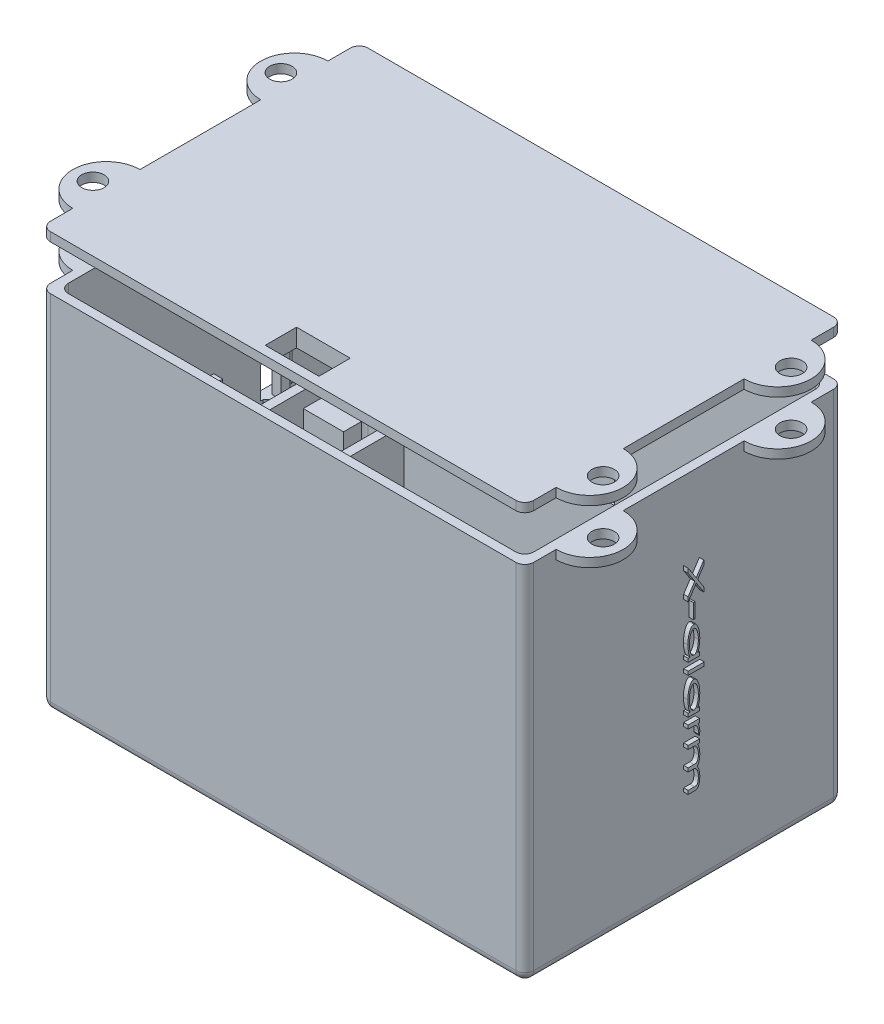
from build123d import *

# Parameters (mm, degrees)
SKETCH1_W                             = 108
SKETCH1_H                             = 71
SKETCH1_W_2                           = 104
SKETCH1_H_2                           = 67
BOX_DEPTH                             = 81
SKETCH3_W                             = 108
SKETCH3_H                             = 71
FRONT_DEPTH                           = 2
FILLET_2_R                            = 2
FILLET_IN_R                           = 2
FILLET2_R                             = 2
FILLET2_IN_R                          = 2
LCD_DEPTH                             = 37
LCD_DEPTH_BACK                        = 54
SKETCH4_W                             = 97
SKETCH4_H                             = 40
LCD_HOLE_START                        = -142
SKETCH5_R                             = 2
LCD_HOLE_DEPTH                        = 183
MIRROR_FOR_LCD_HOLES2_START           = -142
MIRROR_FOR_LCD_HOLES2_COPY_1_SKETCH_R = 2
MIRROR_FOR_LCD_HOLES2_COPY_1_DEPTH    = 183
SKETCH6_W                             = 10
SKETCH6_H                             = 15
SENCEOR_DEPTH                         = 0.5
BACK_DEPTH                            = 2
FILLET_BACK_R                         = 2
FOR_HOLES_DEPTH                       = 2
SKETCH11_R                            = 2.5
HOLES_DEPTH                           = 2
MIRROR_FOR_HOLES1_2_COPY_1_DEPTH      = 2
MIRROR_FOR_HOLES1_2_COPY_2_SKETCH_R   = 2.5
MIRROR_FOR_HOLES1_2_COPY_2_DEPTH      = 2
FOR_HOLES2_DEPTH                      = 2
SKETCH13_R                            = 2.5
HOLES2_DEPTH                          = 2
MIRROR_FOR_HOLES2_2_COPY_1_DEPTH      = 2
MIRROR_FOR_HOLES2_2_COPY_2_SKETCH_R   = 2.5
MIRROR_FOR_HOLES2_2_COPY_2_DEPTH      = 2
SKETCH15_R                            = 4
SKETCH15_W                            = 7
SKETCH15_H                            = 7
DATCHIKI_DEPTH                        = 2
SKETCH17_W                            = 2
SKETCH17_H                            = 14
KNOPKI_DEPTH                          = 2
SKETCH17_W_2                          = 17
SKETCH17_H_2                          = 17
SKETCH17_W_3                          = 13
SKETCH17_H_3                          = 13
KNOPKI_2_DEPTH                        = 2
KNOPKI_3_DEPTH                        = 2
SKETCH18_W                            = 0.358974359
SKETCH18_H                            = 3.320512821
SKETCH18_W_2                          = 3.58974359
SKETCH18_H_2                          = 0.807692307
ALARM_DEPTH                           = 1
SKETCH19_W                            = 104
SKETCH19_H                            = 67
BACK_FIXED_DEPTH                      = 2
BACK_FIXED_FILLET_R                   = 2
PODD_DEPTH                            = 3.5
PODD2_DEPTH                           = 3.5
PODD3_DEPTH                           = 17
ARDXUINO_DEPTH                        = 15
SKETCH23_W                            = 9
SKETCH23_H                            = 4
ARDUINO2_DEPTH                        = 45
SKETCH27_W                            = 12
SKETCH27_H                            = 7
PORT_DEPTH                            = 4
PODD_ARDUINO_DEPTH                    = 20


with BuildPart() as part:
    # Sketch1 → box (new body)
    with BuildSketch(Plane(origin=(0, 0, 0), x_dir=(1, 0, 0), z_dir=(0, 1, 0))):
        Rectangle(SKETCH1_W, SKETCH1_H)
        Rectangle(SKETCH1_W_2, SKETCH1_H_2, mode=Mode.SUBTRACT)
    extrude(amount=BOX_DEPTH)

    # Sketch3 → front (add)
    with BuildSketch(Plane.XZ):
        Rectangle(SKETCH3_W, SKETCH3_H)
    extrude(amount=-FRONT_DEPTH)

    # Fillet 2
    fillet_2_edges = [part.edges().sort_by_distance(p)[0] for p in [
        (54, 40.5, 35.5),
        (-54, 40.5, 35.5),
        (-54, 40.5, -35.5),
        (54, 40.5, -35.5),
    ]]
    fillet(fillet_2_edges, radius=FILLET_2_R)

    # Fillet_in
    fillet_in_edges = [part.edges().sort_by_distance(p)[0] for p in [
        (52, 41.5, 33.5),
        (52, 41.5, -33.5),
        (-52, 41.5, -33.5),
        (-52, 41.5, 33.5),
    ]]
    fillet(fillet_in_edges, radius=FILLET_IN_R)

    # Fillet2
    fillet2_edges = [part.edges().sort_by_distance(p)[0] for p in [
        (0, 0, -35.5),
        (54, 0, 0),
        (0, 0, 35.5),
        (-54, 0, 0),
        (53.414213562, 0, 34.914213562),
        (-53.414213562, 0, -34.914213562),
        (-53.414213562, 0, 34.914213562),
        (53.414213562, 0, -34.914213562),
    ]]
    fillet(fillet2_edges, radius=FILLET2_R)

    # Fillet2_in
    fillet2_in_edges = [part.edges().sort_by_distance(p)[0] for p in [
        (-52, 2, 0),
        (0, 2, 33.5),
        (52, 2, 0),
        (0, 2, -33.5),
        (51.414213562, 2, -32.914213562),
        (-51.414213562, 2, -32.914213562),
        (51.414213562, 2, 32.914213562),
        (-51.414213562, 2, 32.914213562),
    ]]
    fillet(fillet2_in_edges, radius=FILLET2_IN_R)

    # Sketch4 → lcd (cut, two sides: drawn at the far end of the back side and taken through both)
    with BuildSketch(Plane.XZ.offset(-LCD_DEPTH_BACK)):
        Rectangle(SKETCH4_W, SKETCH4_H)
    extrude(amount=LCD_DEPTH + LCD_DEPTH_BACK, mode=Mode.SUBTRACT)

    # Sketch5 → lcd_hole (cut)
    with BuildSketch(Plane.XZ.offset(LCD_HOLE_START)):
        with Locations(Location((-46, 27.5, 0), (0, 0, 90))):
            Circle(SKETCH5_R)
    lcd_hole = extrude(amount=LCD_HOLE_DEPTH, mode=Mode.SUBTRACT)

    # Mirror_for_lcd_holes: lcd_hole across plane
    add(lcd_hole.mirror(Plane(origin=(0, 0, 0), x_dir=(0, 0, 1), z_dir=(1, 0, 0))), mode=Mode.SUBTRACT)

    # Mirror_for_lcd_holes2: lcd_hole across plane
    add(lcd_hole.mirror(Plane.XY), mode=Mode.SUBTRACT)

    # Mirror_for_lcd_holes2 copy 1 sketch → Mirror_for_lcd_holes2 copy 1 (cut)
    with BuildSketch(Plane(origin=(0, 0, 0), x_dir=(-1, 0, 0), z_dir=(0, -1, 0)).offset(MIRROR_FOR_LCD_HOLES2_START)):
        with Locations(Location((-46, 27.5, 0), (0, 0, 90))):
            Circle(MIRROR_FOR_LCD_HOLES2_COPY_1_SKETCH_R)
    extrude(amount=MIRROR_FOR_LCD_HOLES2_COPY_1_DEPTH, mode=Mode.SUBTRACT)

    # Sketch6 → senceor (cut)
    with BuildSketch(Plane.XY.offset(-33.5)):
        with Locations((0, 41.5)):
            Rectangle(SKETCH6_W, SKETCH6_H)
    extrude(amount=-SENCEOR_DEPTH, mode=Mode.SUBTRACT)

    # Sketch12 → for_holes2 (add)
    with BuildSketch(Plane(origin=(0, 81, 0), x_dir=(1, 0, 0), z_dir=(0, 1, 0))):
        with BuildLine():
            Line((-54, 28.5), (-54, 13.5))
            ThreePointArc((-54, 13.5), (-61.5, 21), (-54, 28.5))
        make_face()
    for_holes2 = extrude(amount=-FOR_HOLES2_DEPTH)

    # Sketch13 → holes2 (cut)
    with BuildSketch(Plane(origin=(0, 81, 0), x_dir=(1, 0, 0), z_dir=(0, 1, 0))):
        with Locations(Location((-57, 21, 0), (0, 0, 270))):
            Circle(SKETCH13_R)
    holes2 = extrude(amount=-HOLES2_DEPTH, mode=Mode.SUBTRACT)

    # Mirror_for_holes2_1: for_holes2, holes2 across plane
    add(for_holes2.mirror(Plane(origin=(0, 0, 0), x_dir=(0, 0, 1), z_dir=(1, 0, 0))))
    add(holes2.mirror(Plane(origin=(0, 0, 0), x_dir=(0, 0, 1), z_dir=(1, 0, 0))), mode=Mode.SUBTRACT)

    # Mirror_for_holes2_2: for_holes2, holes2 across plane
    add(for_holes2.mirror(Plane.XY))
    add(holes2.mirror(Plane.XY), mode=Mode.SUBTRACT)

    # Mirror_for_holes2_2 copy 1 sketch → Mirror_for_holes2_2 copy 1 (add)
    with BuildSketch(Plane(origin=(0, 81, 0), x_dir=(-1, 0, 0), z_dir=(0, 1, 0))):
        with BuildLine():
            Line((-54, 28.5), (-54, 13.5))
            ThreePointArc((-54, 13.5), (-61.5, 21), (-54, 28.5))
        make_face()
    extrude(amount=-MIRROR_FOR_HOLES2_2_COPY_1_DEPTH)

    # Mirror_for_holes2_2 copy 2 sketch → Mirror_for_holes2_2 copy 2 (cut)
    with BuildSketch(Plane(origin=(0, 81, 0), x_dir=(-1, 0, 0), z_dir=(0, 1, 0))):
        with Locations(Location((-57, 21, 0), (0, 0, 270))):
            Circle(MIRROR_FOR_HOLES2_2_COPY_2_SKETCH_R)
    extrude(amount=-MIRROR_FOR_HOLES2_2_COPY_2_DEPTH, mode=Mode.SUBTRACT)

    # Sketch15 → datchiki (cut)
    with BuildSketch(Plane.ZY.offset(54)):
        with Locations((15, 40.228974626)):
            Circle(SKETCH15_R)
        with Locations((0, 40.228974626)):
            Rectangle(SKETCH15_W, SKETCH15_H)
        with Locations((-15, 40.228974626)):
            Rectangle(SKETCH15_W, SKETCH15_H)
    extrude(amount=-DATCHIKI_DEPTH, mode=Mode.SUBTRACT)

    # Sketch18 → Alarm (add)
    # profile 1 of 7: a face of its own
    with BuildSketch(Plane(origin=(54, 0, 0), x_dir=(0, 0, -1), z_dir=(1, 0, 0))):
        Polygon((3.5, 63.442307692), (3.5, 62.436899038), (2.136318109, 60.346153846), (3.5, 58.255408654), (3.5, 57.25), (1.808193109, 59.843449519), (0, 57.070512821), (0, 58.075921474), (1.480769231, 60.346153846), (0, 62.616386218), (0, 63.621794872), (1.808193109, 60.848858173), align=None)
    # profile 2 of 7: a face of its own
    with BuildSketch(Plane(origin=(54, 0, 0), x_dir=(0, 0, -1), z_dir=(1, 0, 0))):
        with Locations((1.346153847, 54.71474359)):
            Rectangle(SKETCH18_W, SKETCH18_H)
    # profile 3 of 7: a face of its own
    with BuildSketch(Plane(origin=(54, 0, 0), x_dir=(0, 0, -1), z_dir=(1, 0, 0))):
        with BuildLine():
            Line((2.557692308, 45.381410256), (0, 45.381410256))
            Line((0, 45.381410256), (0, 46.189102564))
            Line((0, 46.189102564), (0.442407853, 46.189102564))
            add(Edge.make_bspline(
                [(0.442407853, 46.189102564), (0.421742508, 46.233358568), (0.380195973, 46.322332825), (0.323530054, 46.459459638), (0.270880462, 46.600459146), (0.222671903, 46.745509289), (0.178374322, 46.894429895), (0.13846366, 47.047375689), (0.102715228, 47.204510644), (0.060422561, 47.421461974), (0.017737864, 47.702491354), (-0.018087637, 48.051595219), (-0.041444755, 48.415779956), (-0.043714399, 48.663791793), (-0.044871795, 48.790264423)],
                knots=[0, 0, 0, 0, 0.658903647, 1.324689472, 2.001141346, 2.689134916, 3.386479509, 4.096959253, 4.821324554, 5.560283517, 7.078698024, 8.654333912, 10.293891161, 12, 12, 12, 12], degree=3))
            add(Edge.make_bspline(
                [(-0.044871795, 48.790264423), (-0.043658669, 48.902936742), (-0.041278605, 49.123991562), (-0.022620965, 49.449335978), (0.007214859, 49.762082107), (0.048780764, 50.062368245), (0.103673512, 50.349876721), (0.170043118, 50.624907515), (0.24823488, 50.887756837), (0.324667565, 51.096708767), (0.390361022, 51.255125825), (0.440946024, 51.365478839), (0.492560871, 51.468177648), (0.545167183, 51.563687793), (0.599912146, 51.650902714), (0.654997211, 51.731569161), (0.712672065, 51.803511408), (0.77074011, 51.868610603), (0.830713797, 51.925585351), (0.891274094, 51.975588629), (0.953806427, 52.017523545), (1.017411689, 52.051835498), (1.082588768, 52.079175872), (1.149321256, 52.097568254), (1.217110979, 52.110587419), (1.262892458, 52.111647653), (1.285857372, 52.112179487)],
                knots=[0, 0, 0, 0, 2.117711671, 4.154794888, 6.12308041, 8.02159497, 9.850641729, 11.622476382, 13.337480136, 15.002332578, 15.801827085, 16.560566352, 17.283516775, 17.9619206, 18.609158598, 19.218432771, 19.796769753, 20.341072745, 20.856851243, 21.35014048, 21.815552153, 22.269567342, 22.706824669, 23.140670544, 23.568943012, 24, 24, 24, 24], degree=3))
            add(Edge.make_bspline(
                [(1.285857372, 52.112179487), (1.308357317, 52.111650212), (1.353215543, 52.110594995), (1.419590237, 52.097531949), (1.485292664, 52.07919942), (1.549074495, 52.051098329), (1.611983853, 52.016755618), (1.673188727, 51.974044167), (1.733562727, 51.92422119), (1.79247685, 51.866372639), (1.85004404, 51.800939492), (1.905977828, 51.727522521), (1.961557106, 51.647153447), (2.014540151, 51.558177388), (2.067094441, 51.462030248), (2.118989584, 51.358628101), (2.168685579, 51.247043295), (2.234466109, 51.087448092), (2.30993994, 50.876349965), (2.388342097, 50.611583002), (2.454980724, 50.334527936), (2.508444719, 50.044677024), (2.551393639, 49.74275266), (2.58116728, 49.428313072), (2.598743712, 49.101531663), (2.601274286, 48.879562453), (2.602564103, 48.766426282)],
                knots=[0, 0, 0, 0, 0.421043031, 0.839435093, 1.263587672, 1.697222692, 2.142211334, 2.605097439, 3.093552727, 3.60770482, 4.15076294, 4.72545226, 5.336542515, 5.981032255, 6.665114799, 7.389857283, 8.14854633, 8.953786346, 10.624612737, 12.347172321, 14.126577142, 15.962352381, 17.868914583, 19.840140219, 21.879748244, 24, 24, 24, 24], degree=3))
            add(Edge.make_bspline(
                [(2.602564103, 48.766426282), (2.602102073, 48.700751331), (2.601189357, 48.57101382), (2.595683157, 48.378613612), (2.585714891, 48.19115757), (2.572618651, 48.008318171), (2.555105675, 47.830168901), (2.533377519, 47.656729405), (2.508044742, 47.487956843), (2.479534059, 47.323984888), (2.446864052, 47.164856738), (2.408837459, 47.010764971), (2.366053989, 46.861628086), (2.319271578, 46.717258885), (2.267906003, 46.577823717), (2.212123918, 46.443396042), (2.150926858, 46.313951806), (2.106500115, 46.230533273), (2.084435096, 46.189102564)],
                knots=[0, 0, 0, 0, 1.186802157, 2.344467023, 3.477842513, 4.578816703, 5.656706767, 6.712224733, 7.737145181, 8.740441498, 9.71945348, 10.672047839, 11.607763232, 12.522612191, 13.413838984, 14.292275929, 15.151840519, 16, 16, 16, 16], degree=3))
            Line((2.084435096, 46.189102564), (2.557692308, 46.189102564))
            Line((2.557692308, 46.189102564), (2.557692308, 45.381410256))
        make_face()
        with BuildLine():
            add(Edge.make_bspline(
                [(2.288461538, 48.721554487), (2.288090591, 48.779287629), (2.287355982, 48.893620155), (2.28048543, 49.063543909), (2.271385159, 49.230308896), (2.256076478, 49.393406088), (2.238445377, 49.553218182), (2.21472026, 49.709483282), (2.188644495, 49.862761348), (2.157553265, 50.011844322), (2.123864312, 50.15534931), (2.085803828, 50.291891763), (2.044558775, 50.421050434), (1.999895553, 50.542700567), (1.952114542, 50.656952508), (1.901133087, 50.763575815), (1.846482204, 50.862691242), (1.788591876, 50.953528529), (1.728850428, 51.035038524), (1.668386761, 51.106713446), (1.606866998, 51.167658069), (1.543443001, 51.216733338), (1.480009195, 51.256508573), (1.414953031, 51.28405538), (1.348885008, 51.301031127), (1.30441553, 51.303341083), (1.282351763, 51.304487179)],
                knots=[0, 0, 0, 0, 1.405801486, 2.783995975, 4.140815387, 5.472212889, 6.772535348, 8.055467822, 9.32043852, 10.558232987, 11.763305795, 12.909349428, 14.00902537, 15.064134583, 16.064017755, 17.023653367, 17.940695263, 18.81847006, 19.6448539, 20.399797193, 21.100054987, 21.748938425, 22.349206193, 22.917887624, 23.463104187, 24, 24, 24, 24], degree=3))
            add(Edge.make_bspline(
                [(1.282351763, 51.304487179), (1.260535547, 51.303298352), (1.216328534, 51.300889386), (1.150419414, 51.284420392), (1.086040329, 51.255194688), (1.022070191, 51.216586114), (0.9589866, 51.166423369), (0.89697474, 51.105370189), (0.83590268, 51.032900298), (0.775306973, 50.950948465), (0.717653712, 50.858960816), (0.662097252, 50.759420317), (0.610553293, 50.652025408), (0.561805665, 50.537261169), (0.517564068, 50.414582328), (0.47518687, 50.284720908), (0.436777272, 50.147136483), (0.390109395, 49.952433817), (0.340480963, 49.699064739), (0.30002991, 49.384750808), (0.273801971, 49.059708416), (0.270770304, 48.839161234), (0.269230769, 48.727163462)],
                knots=[0, 0, 0, 0, 0.443475571, 0.898631151, 1.370896731, 1.876069969, 2.414026017, 3.00533102, 3.642267512, 4.338788751, 5.075578177, 5.847598851, 6.655060735, 7.496002732, 8.38128539, 9.3052925, 10.27245836, 11.28420018, 13.375075964, 15.517196243, 17.723552707, 20, 20, 20, 20], degree=3))
            add(Edge.make_bspline(
                [(0.269230769, 48.727163462), (0.270869782, 48.614005737), (0.274107692, 48.390459955), (0.29916008, 48.059505831), (0.340267262, 47.737676352), (0.388328754, 47.476788456), (0.435684297, 47.276795456), (0.472182519, 47.135717259), (0.512955743, 47.003874397), (0.556491806, 46.880860724), (0.602255135, 46.766323491), (0.652309689, 46.661313477), (0.703969072, 46.5644285), (0.759179312, 46.477126785), (0.816395072, 46.398970251), (0.875981508, 46.331071589), (0.938057406, 46.274086845), (1.000915873, 46.226334916), (1.066447187, 46.190026639), (1.133624633, 46.163947759), (1.202729435, 46.146705453), (1.249767228, 46.145054519), (1.273237179, 46.144230769)],
                knots=[0, 0, 0, 0, 2.287805913, 4.519615117, 6.706427786, 8.845503663, 9.879377515, 10.861651196, 11.791346721, 12.668660028, 13.499648939, 14.283855059, 15.019640971, 15.718396161, 16.370521181, 16.976426115, 17.541602888, 18.071798331, 18.56886665, 19.050627751, 19.526301731, 20, 20, 20, 20], degree=3))
            add(Edge.make_bspline(
                [(1.273237179, 46.144230769), (1.291046945, 46.14468472), (1.326669551, 46.145592701), (1.379364155, 46.155635809), (1.431383537, 46.168957402), (1.481861782, 46.189885065), (1.530709424, 46.216943192), (1.579549192, 46.248315209), (1.62666972, 46.286508841), (1.671811826, 46.331128578), (1.717281733, 46.380127099), (1.760349921, 46.435990599), (1.803216121, 46.496866669), (1.844738408, 46.563771382), (1.884308828, 46.636892854), (1.923743569, 46.715288556), (1.96148645, 46.799888897), (2.011385475, 46.921094678), (2.068011757, 47.082257824), (2.127701921, 47.284569692), (2.177448662, 47.498118237), (2.21742031, 47.722175205), (2.250249172, 47.956917204), (2.27167968, 48.202413092), (2.286589565, 48.458448893), (2.28782951, 48.632722901), (2.288461538, 48.721554487)],
                knots=[0, 0, 0, 0, 0.431395842, 0.862866158, 1.297378955, 1.732113537, 2.183598473, 2.650546566, 3.138326813, 3.651435843, 4.189069441, 4.758314972, 5.360609127, 5.994509329, 6.666760467, 7.376558362, 8.122466708, 8.913002397, 10.555258885, 12.262816725, 14.026869162, 15.870315974, 17.781438047, 19.773658302, 21.845733618, 24, 24, 24, 24], degree=3))
        make_face(mode=Mode.SUBTRACT)
    # profile 4 of 7: a face of its own
    with BuildSketch(Plane(origin=(54, 0, 0), x_dir=(0, 0, -1), z_dir=(1, 0, 0))):
        with Locations((1.794871795, 43.272435898)):
            Rectangle(SKETCH18_W_2, SKETCH18_H_2)
    # profile 5 of 7: a face of its own
    with BuildSketch(Plane(origin=(54, 0, 0), x_dir=(0, 0, -1), z_dir=(1, 0, 0))):
        with BuildLine():
            Line((2.557692308, 34.746794872), (0, 34.746794872))
            Line((0, 34.746794872), (0, 35.554487179))
            Line((0, 35.554487179), (0.442407853, 35.554487179))
            add(Edge.make_bspline(
                [(0.442407853, 35.554487179), (0.421742508, 35.598743183), (0.380195973, 35.68771744), (0.323530054, 35.824844253), (0.270880462, 35.965843762), (0.222671903, 36.110893905), (0.178374322, 36.25981451), (0.13846366, 36.412760305), (0.102715228, 36.569895259), (0.060422561, 36.78684659), (0.017737864, 37.067875969), (-0.018087637, 37.416979834), (-0.041444755, 37.781164571), (-0.043714399, 38.029176409), (-0.044871795, 38.155649038)],
                knots=[0, 0, 0, 0, 0.658903647, 1.324689472, 2.001141346, 2.689134916, 3.386479509, 4.096959253, 4.821324554, 5.560283517, 7.078698024, 8.654333912, 10.293891161, 12, 12, 12, 12], degree=3))
            add(Edge.make_bspline(
                [(-0.044871795, 38.155649038), (-0.043658669, 38.268321357), (-0.041278605, 38.489376177), (-0.022620965, 38.814720594), (0.007214859, 39.127466722), (0.048780764, 39.427752861), (0.103673512, 39.715261336), (0.170043118, 39.99029213), (0.24823488, 40.253141453), (0.324667565, 40.462093382), (0.390361022, 40.62051044), (0.440946024, 40.730863455), (0.492560871, 40.833562263), (0.545167183, 40.929072409), (0.599912146, 41.01628733), (0.654997211, 41.096953776), (0.712672065, 41.168896023), (0.77074011, 41.233995219), (0.830713797, 41.290969966), (0.891274094, 41.340973244), (0.953806427, 41.382908161), (1.017411689, 41.417220113), (1.082588768, 41.444560487), (1.149321256, 41.46295287), (1.217110979, 41.475972035), (1.262892458, 41.477032268), (1.285857372, 41.477564103)],
                knots=[0, 0, 0, 0, 2.117711671, 4.154794888, 6.12308041, 8.02159497, 9.850641729, 11.622476382, 13.337480136, 15.002332578, 15.801827085, 16.560566352, 17.283516775, 17.9619206, 18.609158598, 19.218432771, 19.796769753, 20.341072745, 20.856851243, 21.35014048, 21.815552153, 22.269567342, 22.706824669, 23.140670544, 23.568943012, 24, 24, 24, 24], degree=3))
            add(Edge.make_bspline(
                [(1.285857372, 41.477564103), (1.308357317, 41.477034828), (1.353215543, 41.47597961), (1.419590237, 41.462916565), (1.485292664, 41.444584035), (1.549074495, 41.416482944), (1.611983853, 41.382140234), (1.673188727, 41.339428783), (1.733562727, 41.289605806), (1.79247685, 41.231757255), (1.85004404, 41.166324107), (1.905977828, 41.092907136), (1.961557106, 41.012538062), (2.014540151, 40.923562003), (2.067094441, 40.827414863), (2.118989584, 40.724012716), (2.168685579, 40.61242791), (2.234466109, 40.452832707), (2.30993994, 40.24173458), (2.388342097, 39.976967618), (2.454980724, 39.699912551), (2.508444719, 39.410061639), (2.551393639, 39.108137276), (2.58116728, 38.793697688), (2.598743712, 38.466916279), (2.601274286, 38.244947068), (2.602564103, 38.131810897)],
                knots=[0, 0, 0, 0, 0.421043031, 0.839435093, 1.263587672, 1.697222692, 2.142211334, 2.605097439, 3.093552727, 3.60770482, 4.15076294, 4.72545226, 5.336542515, 5.981032255, 6.665114799, 7.389857283, 8.14854633, 8.953786346, 10.624612737, 12.347172321, 14.126577142, 15.962352381, 17.868914583, 19.840140219, 21.879748244, 24, 24, 24, 24], degree=3))
            add(Edge.make_bspline(
                [(2.602564103, 38.131810897), (2.602102073, 38.066135946), (2.601189357, 37.936398436), (2.595683157, 37.743998227), (2.585714891, 37.556542185), (2.572618651, 37.373702787), (2.555105675, 37.195553516), (2.533377519, 37.02211402), (2.508044742, 36.853341458), (2.479534059, 36.689369504), (2.446864052, 36.530241354), (2.408837459, 36.376149586), (2.366053989, 36.227012702), (2.319271578, 36.0826435), (2.267906003, 35.943208332), (2.212123918, 35.808780658), (2.150926858, 35.679336422), (2.106500115, 35.595917889), (2.084435096, 35.554487179)],
                knots=[0, 0, 0, 0, 1.186802157, 2.344467023, 3.477842513, 4.578816703, 5.656706767, 6.712224733, 7.737145181, 8.740441498, 9.71945348, 10.672047839, 11.607763232, 12.522612191, 13.413838984, 14.292275929, 15.151840519, 16, 16, 16, 16], degree=3))
            Line((2.084435096, 35.554487179), (2.557692308, 35.554487179))
            Line((2.557692308, 35.554487179), (2.557692308, 34.746794872))
        make_face()
        with BuildLine():
            add(Edge.make_bspline(
                [(2.288461538, 38.086939103), (2.288090591, 38.144672245), (2.287355982, 38.259004771), (2.28048543, 38.428928524), (2.271385159, 38.595693511), (2.256076478, 38.758790704), (2.238445377, 38.918602797), (2.21472026, 39.074867898), (2.188644495, 39.228145963), (2.157553265, 39.377228938), (2.123864312, 39.520733926), (2.085803828, 39.657276378), (2.044558775, 39.78643505), (1.999895553, 39.908085183), (1.952114542, 40.022337123), (1.901133087, 40.12896043), (1.846482204, 40.228075857), (1.788591876, 40.318913144), (1.728850428, 40.400423139), (1.668386761, 40.472098062), (1.606866998, 40.533042684), (1.543443001, 40.582117953), (1.480009195, 40.621893189), (1.414953031, 40.649439995), (1.348885008, 40.666415743), (1.30441553, 40.668725698), (1.282351763, 40.669871795)],
                knots=[0, 0, 0, 0, 1.405801486, 2.783995975, 4.140815387, 5.472212889, 6.772535348, 8.055467822, 9.32043852, 10.558232987, 11.763305795, 12.909349428, 14.00902537, 15.064134583, 16.064017755, 17.023653367, 17.940695263, 18.81847006, 19.6448539, 20.399797193, 21.100054987, 21.748938425, 22.349206193, 22.917887624, 23.463104187, 24, 24, 24, 24], degree=3))
            add(Edge.make_bspline(
                [(1.282351763, 40.669871795), (1.260535547, 40.668682967), (1.216328534, 40.666274002), (1.150419414, 40.649805007), (1.086040329, 40.620579303), (1.022070191, 40.581970729), (0.9589866, 40.531807985), (0.89697474, 40.470754804), (0.83590268, 40.398284913), (0.775306973, 40.31633308), (0.717653712, 40.224345432), (0.662097252, 40.124804932), (0.610553293, 40.017410024), (0.561805665, 39.902645784), (0.517564068, 39.779966943), (0.47518687, 39.650105524), (0.436777272, 39.512521098), (0.390109395, 39.317818432), (0.340480963, 39.064449354), (0.30002991, 38.750135423), (0.273801971, 38.425093031), (0.270770304, 38.204545849), (0.269230769, 38.092548077)],
                knots=[0, 0, 0, 0, 0.443475571, 0.898631151, 1.370896731, 1.876069969, 2.414026017, 3.00533102, 3.642267512, 4.338788751, 5.075578177, 5.847598851, 6.655060735, 7.496002732, 8.38128539, 9.3052925, 10.27245836, 11.28420018, 13.375075964, 15.517196243, 17.723552707, 20, 20, 20, 20], degree=3))
            add(Edge.make_bspline(
                [(0.269230769, 38.092548077), (0.270869782, 37.979390353), (0.274107692, 37.755844571), (0.29916008, 37.424890447), (0.340267262, 37.103060967), (0.388328754, 36.842173071), (0.435684297, 36.642180072), (0.472182519, 36.501101874), (0.512955743, 36.369259013), (0.556491806, 36.246245339), (0.602255135, 36.131708106), (0.652309689, 36.026698092), (0.703969072, 35.929813115), (0.759179312, 35.8425114), (0.816395072, 35.764354866), (0.875981508, 35.696456204), (0.938057406, 35.639471461), (1.000915873, 35.591719531), (1.066447187, 35.555411255), (1.133624633, 35.529332374), (1.202729435, 35.512090069), (1.249767228, 35.510439134), (1.273237179, 35.509615385)],
                knots=[0, 0, 0, 0, 2.287805913, 4.519615117, 6.706427786, 8.845503663, 9.879377515, 10.861651196, 11.791346721, 12.668660028, 13.499648939, 14.283855059, 15.019640971, 15.718396161, 16.370521181, 16.976426115, 17.541602888, 18.071798331, 18.56886665, 19.050627751, 19.526301731, 20, 20, 20, 20], degree=3))
            add(Edge.make_bspline(
                [(1.273237179, 35.509615385), (1.291046945, 35.510069336), (1.326669551, 35.510977316), (1.379364155, 35.521020425), (1.431383537, 35.534342017), (1.481861782, 35.55526968), (1.530709424, 35.582327807), (1.579549192, 35.613699824), (1.62666972, 35.651893457), (1.671811826, 35.696513193), (1.717281733, 35.745511714), (1.760349921, 35.801375214), (1.803216121, 35.862251284), (1.844738408, 35.929155998), (1.884308828, 36.002277469), (1.923743569, 36.080673171), (1.96148645, 36.165273512), (2.011385475, 36.286479294), (2.068011757, 36.447642439), (2.127701921, 36.649954308), (2.177448662, 36.863502852), (2.21742031, 37.08755982), (2.250249172, 37.322301819), (2.27167968, 37.567797707), (2.286589565, 37.823833509), (2.28782951, 37.998107516), (2.288461538, 38.086939103)],
                knots=[0, 0, 0, 0, 0.431395842, 0.862866158, 1.297378955, 1.732113537, 2.183598473, 2.650546566, 3.138326813, 3.651435843, 4.189069441, 4.758314972, 5.360609127, 5.994509329, 6.666760467, 7.376558362, 8.122466708, 8.913002397, 10.555258885, 12.262816725, 14.026869162, 15.870315974, 17.781438047, 19.773658302, 21.845733618, 24, 24, 24, 24], degree=3))
        make_face(mode=Mode.SUBTRACT)
    # profile 6 of 7: a face of its own
    with BuildSketch(Plane(origin=(54, 0, 0), x_dir=(0, 0, -1), z_dir=(1, 0, 0))):
        with BuildLine():
            Line((2.557692308, 33.266025641), (2.557692308, 32.458333333))
            Line((2.557692308, 32.458333333), (2.181189904, 32.458333333))
            add(Edge.make_bspline(
                [(2.181189904, 32.458333333), (2.216770522, 32.393161728), (2.28756922, 32.263482565), (2.375854138, 32.060603506), (2.447969467, 31.852504596), (2.50564591, 31.639492053), (2.548521055, 31.421459776), (2.580453975, 31.199196897), (2.598765447, 30.972031802), (2.601290065, 30.819142226), (2.602564103, 30.741987179)],
                knots=[0, 0, 0, 0, 0.996469437, 1.982785624, 2.966128, 3.951010882, 4.942920497, 5.947502343, 6.964216161, 8, 8, 8, 8], degree=3))
            add(Edge.make_bspline(
                [(2.602564103, 30.741987179), (2.601398056, 30.682356852), (2.599025385, 30.561021071), (2.58200987, 30.375894547), (2.555161892, 30.184593612), (2.528503495, 30.05592671), (2.514923878, 29.990384615)],
                knots=[0, 0, 0, 0, 0.943831684, 1.920508571, 2.940720417, 4, 4, 4, 4], degree=3))
            Line((2.514923878, 29.990384615), (2.242888622, 30.418770032))
            add(Edge.make_bspline(
                [(2.242888622, 30.418770032), (2.2496529, 30.461739763), (2.26260655, 30.544027155), (2.277667845, 30.662256672), (2.286578379, 30.770126663), (2.287854781, 30.838494062), (2.288461538, 30.87099359)],
                knots=[0, 0, 0, 0, 1.147204346, 2.196905842, 3.142870602, 4, 4, 4, 4], degree=3))
            add(Edge.make_bspline(
                [(2.288461538, 30.87099359), (2.28687032, 30.941649047), (2.283709244, 31.082011502), (2.257511115, 31.290490514), (2.215448715, 31.495178684), (2.166779212, 31.661702978), (2.119656436, 31.790304646), (2.07872839, 31.880762787), (2.034162448, 31.965906734), (1.98434774, 32.044807168), (1.92903334, 32.117167636), (1.870461205, 32.184835655), (1.806634254, 32.246160852), (1.760376808, 32.282041606), (1.737379808, 32.299879808)],
                knots=[0, 0, 0, 0, 1.604899353, 3.18825498, 4.765982142, 6.348803436, 7.12505152, 7.876099285, 8.602955166, 9.30711211, 9.993177446, 10.670536201, 11.339053906, 12, 12, 12, 12], degree=3))
            add(Edge.make_bspline(
                [(1.737379808, 32.299879808), (1.717383656, 32.312885522), (1.67452628, 32.340760424), (1.598135364, 32.371870301), (1.508702854, 32.398994176), (1.405500594, 32.421153928), (1.288514879, 32.43720483), (1.158034584, 32.450087787), (1.01341708, 32.456467978), (0.912397707, 32.457692854), (0.859575321, 32.458333333)],
                knots=[0, 0, 0, 0, 0.632497709, 1.355620455, 2.180469504, 3.114526086, 4.155889769, 5.316106813, 6.596609361, 8, 8, 8, 8], degree=3))
            Line((0.859575321, 32.458333333), (0, 32.458333333))
            Line((0, 32.458333333), (0, 33.266025641))
            Line((0, 33.266025641), (2.557692308, 33.266025641))
        make_face()
    # profile 7 of 7: a face of its own
    with BuildSketch(Plane(origin=(54, 0, 0), x_dir=(0, 0, -1), z_dir=(1, 0, 0))):
        with BuildLine():
            Line((2.557692308, 29.317307692), (2.557692308, 28.509615385))
            Line((2.557692308, 28.509615385), (2.11318109, 28.509615385))
            add(Edge.make_bspline(
                [(2.11318109, 28.509615385), (2.152552786, 28.438161648), (2.230509685, 28.296681544), (2.328280876, 28.076832942), (2.41056328, 27.854634303), (2.452181425, 27.703423897), (2.472856571, 27.628305288)],
                knots=[0, 0, 0, 0, 1.025009336, 2.02954295, 3.021112399, 4, 4, 4, 4], degree=3))
            add(Edge.make_bspline(
                [(2.472856571, 27.628305288), (2.49296111, 27.523328858), (2.533495671, 27.311676475), (2.573195271, 26.987604304), (2.597524425, 26.655527267), (2.600871502, 26.431299572), (2.602564103, 26.317908654)],
                knots=[0, 0, 0, 0, 0.972195158, 1.960129712, 2.968446937, 4, 4, 4, 4], degree=3))
            add(Edge.make_bspline(
                [(2.602564103, 26.317908654), (2.601514942, 26.24146945), (2.599443911, 26.090579364), (2.58620121, 25.867124681), (2.562957905, 25.649588109), (2.531192398, 25.439958975), (2.49182315, 25.24296275), (2.446610163, 25.062566071), (2.395364053, 24.90112981), (2.336737438, 24.756808879), (2.268479555, 24.626165339), (2.187238342, 24.50680744), (2.093747619, 24.395004032), (2.021457481, 24.329647513), (1.984875801, 24.296574519)],
                knots=[0, 0, 0, 0, 1.264371881, 2.495855161, 3.700991407, 4.881896394, 6.001647533, 7.022666807, 7.956662252, 8.800880844, 9.596312771, 10.389722549, 11.185135689, 12, 12, 12, 12], degree=3))
            add(Edge.make_bspline(
                [(1.984875801, 24.296574519), (2.00986823, 24.261821937), (2.060354979, 24.191618882), (2.128565897, 24.079421033), (2.193607225, 23.961612914), (2.252520029, 23.836647247), (2.308556876, 23.705979244), (2.35833195, 23.568523026), (2.405217567, 23.425164477), (2.445688649, 23.275625057), (2.483240143, 23.121955883), (2.514359532, 22.964384904), (2.541758722, 22.804282822), (2.564555668, 22.641127273), (2.580739833, 22.475002534), (2.59390375, 22.306034527), (2.60056986, 22.134134711), (2.601895931, 22.018634241), (2.602564103, 21.960436699)],
                knots=[0, 0, 0, 0, 0.836702089, 1.690206606, 2.565489576, 3.466877, 4.390326977, 5.344505649, 6.324296002, 7.338694482, 8.372787504, 9.416848499, 10.478374116, 11.548578826, 12.637133533, 13.741495583, 14.862001114, 16, 16, 16, 16], degree=3))
            add(Edge.make_bspline(
                [(2.602564103, 21.960436699), (2.602161586, 21.906444809), (2.601366727, 21.799825799), (2.595034019, 21.642465613), (2.584243304, 21.48984161), (2.570787637, 21.341966755), (2.551704492, 21.198882612), (2.528380113, 21.060768673), (2.502267789, 20.927251768), (2.470526303, 20.799452608), (2.435821679, 20.678026882), (2.39802863, 20.563980808), (2.35697883, 20.458024564), (2.311806429, 20.360392706), (2.264575629, 20.270278423), (2.213109755, 20.188566116), (2.158624046, 20.114638133), (2.099956482, 20.048679458), (2.036282446, 19.989904855), (1.964854664, 19.94017003), (1.886348832, 19.897702482), (1.800372739, 19.863577192), (1.707140472, 19.836795531), (1.606370931, 19.818467372), (1.49837779, 19.805945047), (1.423782838, 19.80498233), (1.385416667, 19.804487179)],
                knots=[0, 0, 0, 0, 1.392185431, 2.749180156, 4.060000931, 5.337242931, 6.577322499, 7.781038535, 8.948704855, 10.084364722, 11.175369013, 12.204432676, 13.181394714, 14.103571343, 14.977026951, 15.80297757, 16.591221793, 17.342405296, 18.076126697, 18.820120746, 19.580505944, 20.372794121, 21.200567427, 22.077549984, 23.011232741, 24, 24, 24, 24], degree=3))
            Line((1.385416667, 19.804487179), (0, 19.804487179))
            Line((0, 19.804487179), (0, 20.612179487))
            Line((0, 20.612179487), (1.38681891, 20.612179487))
            add(Edge.make_bspline(
                [(1.38681891, 20.612179487), (1.41955335, 20.612479611), (1.482533785, 20.613057044), (1.572872799, 20.620292541), (1.655400367, 20.631098464), (1.729858095, 20.646897273), (1.796264685, 20.667981249), (1.85485439, 20.693158546), (1.906135927, 20.722224578), (1.949383789, 20.757856757), (1.98720818, 20.799267981), (2.022661158, 20.846113919), (2.056528949, 20.899389944), (2.088783338, 20.958721852), (2.117962823, 21.025360635), (2.145905038, 21.097855916), (2.171749734, 21.177042551), (2.196366875, 21.262038491), (2.217646278, 21.352676659), (2.23677845, 21.447818687), (2.252721227, 21.547469763), (2.266208685, 21.651488634), (2.275472077, 21.759834757), (2.283690541, 21.872220446), (2.287613375, 21.989154218), (2.288175565, 22.068641172), (2.288461538, 22.109074519)],
                knots=[0, 0, 0, 0, 1.169601632, 2.250291154, 3.236614929, 4.142569057, 4.966708169, 5.722356251, 6.418566075, 7.065592556, 7.715684639, 8.418972887, 9.162709996, 9.969957904, 10.829888053, 11.760569581, 12.745761033, 13.805855416, 14.922109672, 16.072011278, 17.273506288, 18.528088252, 19.819658979, 21.159194293, 22.554941712, 24, 24, 24, 24], degree=3))
            add(Edge.make_bspline(
                [(2.288461538, 22.109074519), (2.288049737, 22.158392347), (2.28723555, 22.255900393), (2.280985153, 22.400668277), (2.269585006, 22.542338623), (2.25438392, 22.680794278), (2.234579581, 22.815929842), (2.211004844, 22.947926894), (2.182134376, 23.076725476), (2.149432771, 23.201624858), (2.113272253, 23.320696867), (2.074448034, 23.432582458), (2.031132403, 23.535604668), (1.98710313, 23.63130532), (1.938418862, 23.717790016), (1.887091011, 23.796016029), (1.833490342, 23.866357526), (1.775673783, 23.928777068), (1.711880961, 23.984223268), (1.637805217, 24.030418143), (1.554452494, 24.069715205), (1.461300537, 24.101779081), (1.358470528, 24.126752745), (1.245969363, 24.144863119), (1.123625233, 24.155175318), (1.038848602, 24.156410723), (0.994891827, 24.157051282)],
                knots=[0, 0, 0, 0, 1.285193175, 2.541001534, 3.775104896, 4.988414596, 6.17013033, 7.333689559, 8.481796768, 9.608922464, 10.69746025, 11.724130971, 12.693434196, 13.608852101, 14.467785429, 15.276908189, 16.045571795, 16.769529415, 17.490895003, 18.241071545, 19.036555779, 19.887898334, 20.803721345, 21.790958949, 22.854609825, 24, 24, 24, 24], degree=3))
            Line((0.994891827, 24.157051282), (0, 24.157051282))
            Line((0, 24.157051282), (0, 24.96474359))
            Line((0, 24.96474359), (1.300580929, 24.96474359))
            add(Edge.make_bspline(
                [(1.300580929, 24.96474359), (1.337288191, 24.96504023), (1.407971388, 24.965611438), (1.509261696, 24.972895064), (1.601654628, 24.983417476), (1.684376999, 25.000010433), (1.758628149, 25.018451991), (1.82295575, 25.044328377), (1.878812029, 25.073075234), (1.926083904, 25.107965787), (1.966778378, 25.148940108), (2.00561429, 25.195006568), (2.040831049, 25.249033707), (2.075553238, 25.308342224), (2.106711187, 25.375080942), (2.137264173, 25.447778488), (2.163845895, 25.528020002), (2.190111032, 25.613852369), (2.212851832, 25.705431427), (2.233151313, 25.801549194), (2.250859875, 25.902049378), (2.264686247, 26.006859139), (2.275054044, 26.115860383), (2.282685817, 26.22901611), (2.287868618, 26.346372597), (2.288262028, 26.42610943), (2.288461538, 26.466546474)],
                knots=[0, 0, 0, 0, 1.263644356, 2.433263039, 3.495282839, 4.462724843, 5.337210114, 6.124728464, 6.844718698, 7.494952096, 8.137974921, 8.829333793, 9.565863377, 10.355393795, 11.194043975, 12.099669251, 13.069250876, 14.102872503, 15.189992219, 16.316890548, 17.48509653, 18.702862066, 19.956008462, 21.254631507, 22.607737708, 24, 24, 24, 24], degree=3))
            add(Edge.make_bspline(
                [(2.288461538, 26.466546474), (2.286969477, 26.560327151), (2.284031526, 26.744986391), (2.257072993, 27.017355183), (2.214799959, 27.280454526), (2.16516947, 27.492340627), (2.117540921, 27.653637112), (2.079079656, 27.765979986), (2.03767058, 27.870452016), (1.993103381, 27.966616317), (1.946013727, 28.055127607), (1.895835504, 28.135386424), (1.841383636, 28.206752762), (1.785270415, 28.272050914), (1.722861315, 28.328792743), (1.653360044, 28.377925792), (1.57549384, 28.418296492), (1.490499781, 28.452044461), (1.397607009, 28.477847179), (1.297466838, 28.496549957), (1.189366189, 28.507952747), (1.11481269, 28.509048299), (1.076221955, 28.509615385)],
                knots=[0, 0, 0, 0, 2.100264735, 4.135535204, 6.124548437, 8.066146269, 9.005354851, 9.891098493, 10.725209553, 11.52158337, 12.264062958, 12.969945165, 13.639010111, 14.273336991, 14.895954629, 15.523417614, 16.17444044, 16.855925097, 17.568569708, 18.330434261, 19.135791469, 20, 20, 20, 20], degree=3))
            Line((1.076221955, 28.509615385), (0, 28.509615385))
            Line((0, 28.509615385), (0, 29.317307692))
            Line((0, 29.317307692), (2.557692308, 29.317307692))
        make_face()
    extrude(amount=ALARM_DEPTH)


with BuildPart() as body_2:
    # Sketch9 → back (new body)
    with BuildSketch(Plane(origin=(0, 91, 0), x_dir=(1, 0, 0), z_dir=(0, 1, 0))):
        Polygon((-54, -35.5), (54, -35.5), (54, 35.5), (4.005186461, 35.5), (-4.005186461, 35.5), (-54, 35.5), align=None)
    extrude(amount=BACK_DEPTH)

    # Fillet_back
    fillet_back_edges = [body_2.edges().sort_by_distance(p)[0] for p in [
        (-54, 92, -35.5),
        (54, 92, -35.5),
        (54, 92, 35.5),
        (-54, 92, 35.5),
    ]]
    fillet(fillet_back_edges, radius=FILLET_BACK_R)

    # Sketch10 → for_holes (add)
    with BuildSketch(Plane(origin=(0, 93, 0), x_dir=(1, 0, 0), z_dir=(0, 1, 0))):
        with BuildLine():
            Line((-54, 28.5), (-54, 13.5))
            ThreePointArc((-54, 13.5), (-61.5, 21), (-54, 28.5))
        make_face()
    for_holes = extrude(amount=-FOR_HOLES_DEPTH)

    # Sketch11 → holes (cut)
    with BuildSketch(Plane(origin=(0, 93, 0), x_dir=(1, 0, 0), z_dir=(0, 1, 0))):
        with Locations(Location((-57, 21, 0), (0, 0, 270))):
            Circle(SKETCH11_R)
    holes = extrude(amount=-HOLES_DEPTH, mode=Mode.SUBTRACT)

    # Mirror_for_holes1_1: for_holes, holes across plane
    add(for_holes.mirror(Plane(origin=(0, 0, 0), x_dir=(0, 0, 1), z_dir=(1, 0, 0))))
    add(holes.mirror(Plane(origin=(0, 0, 0), x_dir=(0, 0, 1), z_dir=(1, 0, 0))), mode=Mode.SUBTRACT)

    # Mirror_for_holes1_2: for_holes, holes across plane
    add(for_holes.mirror(Plane.XY))
    add(holes.mirror(Plane.XY), mode=Mode.SUBTRACT)

    # Mirror_for_holes1_2 copy 1 sketch → Mirror_for_holes1_2 copy 1 (add)
    with BuildSketch(Plane(origin=(0, 93, 0), x_dir=(-1, 0, 0), z_dir=(0, 1, 0))):
        with BuildLine():
            Line((-54, 28.5), (-54, 13.5))
            ThreePointArc((-54, 13.5), (-61.5, 21), (-54, 28.5))
        make_face()
    extrude(amount=-MIRROR_FOR_HOLES1_2_COPY_1_DEPTH)

    # Mirror_for_holes1_2 copy 2 sketch → Mirror_for_holes1_2 copy 2 (cut)
    with BuildSketch(Plane(origin=(0, 93, 0), x_dir=(-1, 0, 0), z_dir=(0, 1, 0))):
        with Locations(Location((-57, 21, 0), (0, 0, 270))):
            Circle(MIRROR_FOR_HOLES1_2_COPY_2_SKETCH_R)
    extrude(amount=-MIRROR_FOR_HOLES1_2_COPY_2_DEPTH, mode=Mode.SUBTRACT)

    # Sketch19 → back_fixed (add)
    with BuildSketch(Plane.XZ.offset(-91)):
        Rectangle(SKETCH19_W, SKETCH19_H)
    extrude(amount=BACK_FIXED_DEPTH)

    # back_fixed_fillet
    back_fixed_fillet_edges = [body_2.edges().sort_by_distance(p)[0] for p in [
        (-52, 90, 33.5),
        (-52, 90, -33.5),
        (52, 90, -33.5),
        (52, 90, 33.5),
    ]]
    fillet(back_fixed_fillet_edges, radius=BACK_FIXED_FILLET_R)

    # Sketch27 → port (cut)
    with BuildSketch(Plane.XZ.offset(-89)):
        with Locations((0, 30)):
            Rectangle(SKETCH27_W, SKETCH27_H)
    extrude(amount=-PORT_DEPTH, mode=Mode.SUBTRACT)


with BuildPart() as body_3:
    # Sketch17 → knopki (new body)
    with BuildSketch(Plane(origin=(-52, 0, 0), x_dir=(0, 0, -1), z_dir=(1, 0, 0))):
        with Locations((0, 40.22897463)):
            Rectangle(SKETCH17_W, SKETCH17_H)
    extrude(amount=KNOPKI_DEPTH)


    add(part.part)  # podd merges part
    # Sketch20 → podd (add)
    with BuildSketch(Plane.XZ.offset(-33.22897463)):
        Polygon((-50, 1), (-52, 1), (-52, 3), align=None)
        Polygon((-50, -14), (-52, -14), (-52, -12), align=None)
    extrude(amount=-PODD_DEPTH)



with BuildPart() as body_4:
    # Sketch17 → knopki 2 (new body)
    with BuildSketch(Plane(origin=(-52, 0, 0), x_dir=(0, 0, -1), z_dir=(1, 0, 0))):
        with Locations((-15, 40.228974626)):
            Rectangle(SKETCH17_W_2, SKETCH17_H_2)
        with Locations((-15, 40.228974626)):
            Rectangle(SKETCH17_W_3, SKETCH17_H_3, mode=Mode.SUBTRACT)
    extrude(amount=KNOPKI_2_DEPTH)


with BuildPart() as body_5:
    # Sketch17 → knopki 3 (new body)
    with BuildSketch(Plane(origin=(-52, 0, 0), x_dir=(0, 0, -1), z_dir=(1, 0, 0))):
        with Locations((15, 40.22897463)):
            Rectangle(SKETCH17_W, SKETCH17_H)
    extrude(amount=KNOPKI_3_DEPTH)


with BuildPart() as body_3_1:
    add(body_3.part)

    add(body_5.part)  # podd2 merges body 5
    # Sketch24 → podd2 (add)
    with BuildSketch(Plane(origin=(0, 47.22897463, 0), x_dir=(1, 0, 0), z_dir=(0, 1, 0))):
        Polygon((-52, 14), (-50, 14), (-52, 12), align=None)
        Polygon((-52, -1), (-50, -1), (-52, -3), align=None)
    extrude(amount=-PODD2_DEPTH)


    add(body_4.part)  # podd3 merges body 4
    # Sketch25 → podd3 (add)
    with BuildSketch(Plane(origin=(0, 48.728974626, 0), x_dir=(1, 0, 0), z_dir=(0, 1, 0))):
        Polygon((-52, -23.5), (-50, -23.5), (-52, -25.5), align=None)
    extrude(amount=-PODD3_DEPTH)

    # Sketch22 → ardxuino (add)
    with BuildSketch(Plane(origin=(0, 0, 33.5), x_dir=(-1, 0, 0), z_dir=(0, 0, -1))):
        Polygon((10, 31), (-10, 31), (-10, 78), (-8, 78), (-8, 33), (8, 33), (8, 78), (10, 78), align=None)
    extrude(amount=ARDXUINO_DEPTH)

    # Sketch23 → arduino2 (add)
    with BuildSketch(Plane(origin=(0, 33, 0), x_dir=(1, 0, 0), z_dir=(0, 1, 0))):
        with Locations((0, -24.5)):
            Rectangle(SKETCH23_W, SKETCH23_H)
    extrude(amount=ARDUINO2_DEPTH)

    # Sketch28 → podd_arduino (add)
    with BuildSketch(Plane(origin=(10, 0, 0), x_dir=(0, 0, -1), z_dir=(1, 0, 0))):
        Polygon((-18.5, 31), (-33.5, 31), (-33.5, 21), align=None)
    extrude(amount=-PODD_ARDUINO_DEPTH)


solid = Compound([body_2.part, body_3_1.part])
